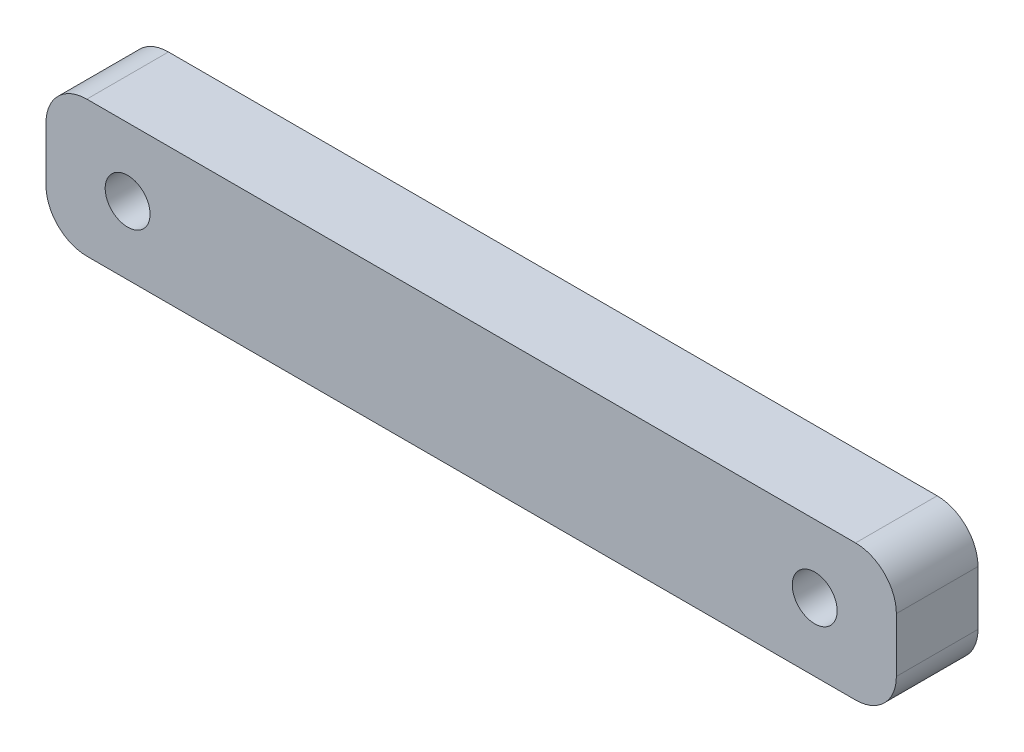
from build123d import *

# Parameters (mm, degrees)
SKETCH1_W           = 62.5
SKETCH1_H           = 10
BOSS_EXTRUDE1_DEPTH = 6
SKETCH2_R           = 1.65
CUT_EXTRUDE1_DEPTH  = 64.578691399
FILLET1_R           = 3


with BuildPart() as part:
    # Sketch1 → Boss-Extrude1 (new body)
    with BuildSketch(Plane.XY):
        with Locations((31.25, -5)):
            Rectangle(SKETCH1_W, SKETCH1_H)
    extrude(amount=BOSS_EXTRUDE1_DEPTH)

    # Sketch2 → Cut-Extrude1 (cut, through all)
    with BuildSketch(Plane.XY.offset(6)):
        with Locations((56.5, -5)):
            Circle(SKETCH2_R)
        with Locations((6, -5)):
            Circle(SKETCH2_R)
    extrude(amount=-CUT_EXTRUDE1_DEPTH, mode=Mode.SUBTRACT)

    # Fillet1
    fillet1_edges = [part.edges().sort_by_distance(p)[0] for p in [
        (0, 0, 3),
        (62.5, 0, 3),
        (62.5, -10, 3),
        (0, -10, 3),
    ]]
    fillet(fillet1_edges, radius=FILLET1_R)


solid = part.part
